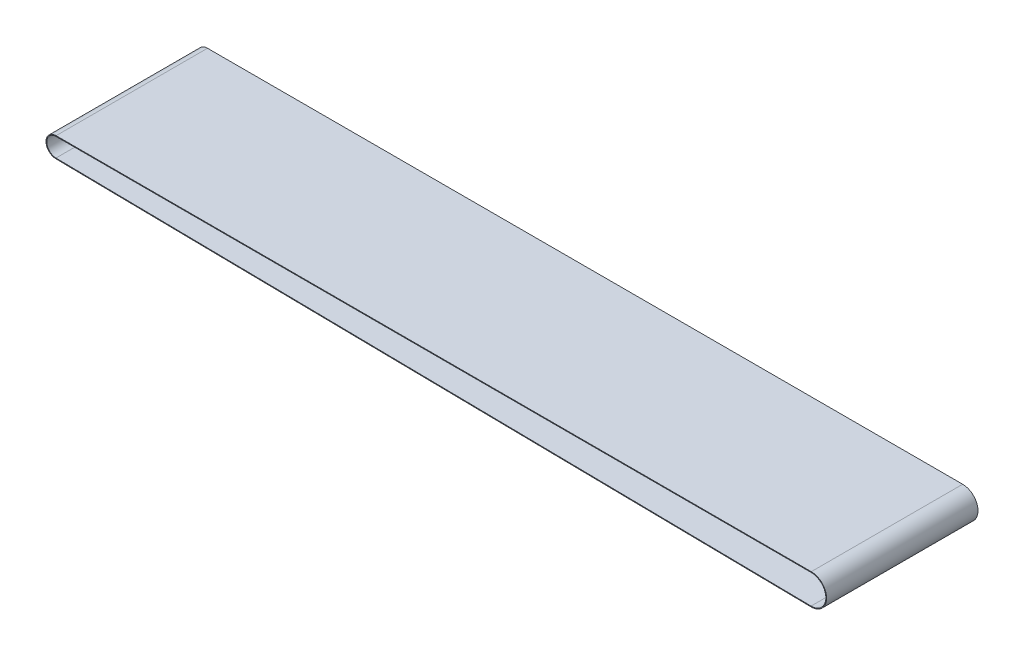
from build123d import *


with BuildPart() as part:
    # Austragung1: sweep along a path in Skizze2
    with BuildLine(Plane.XY) as austragung1_path:
        Line((-2020, 217), (0, 217))
        ThreePointArc((0, 217), (38.99906336, 177.729709462), (-0.540568093, 139.003746512))
        Line((-0.540568093, 139.003746512), (-2020.346518009, 167.00240161))
        ThreePointArc((-2020.346518009, 167.00240161), (-2044.99939959, 192.173263165), (-2020, 217))
    # Skizze3 → Austragung1 (sweep)
    with BuildSketch(Plane(origin=(0, 0, 0), x_dir=(0, 0, -1), z_dir=(1, 0, 0))):
        Polygon((202.5, 219), (-202.5, 219), (-202.5, 217), (0, 217), (202.5, 217), align=None)
    sweep(path=austragung1_path.line)


solid = part.part
